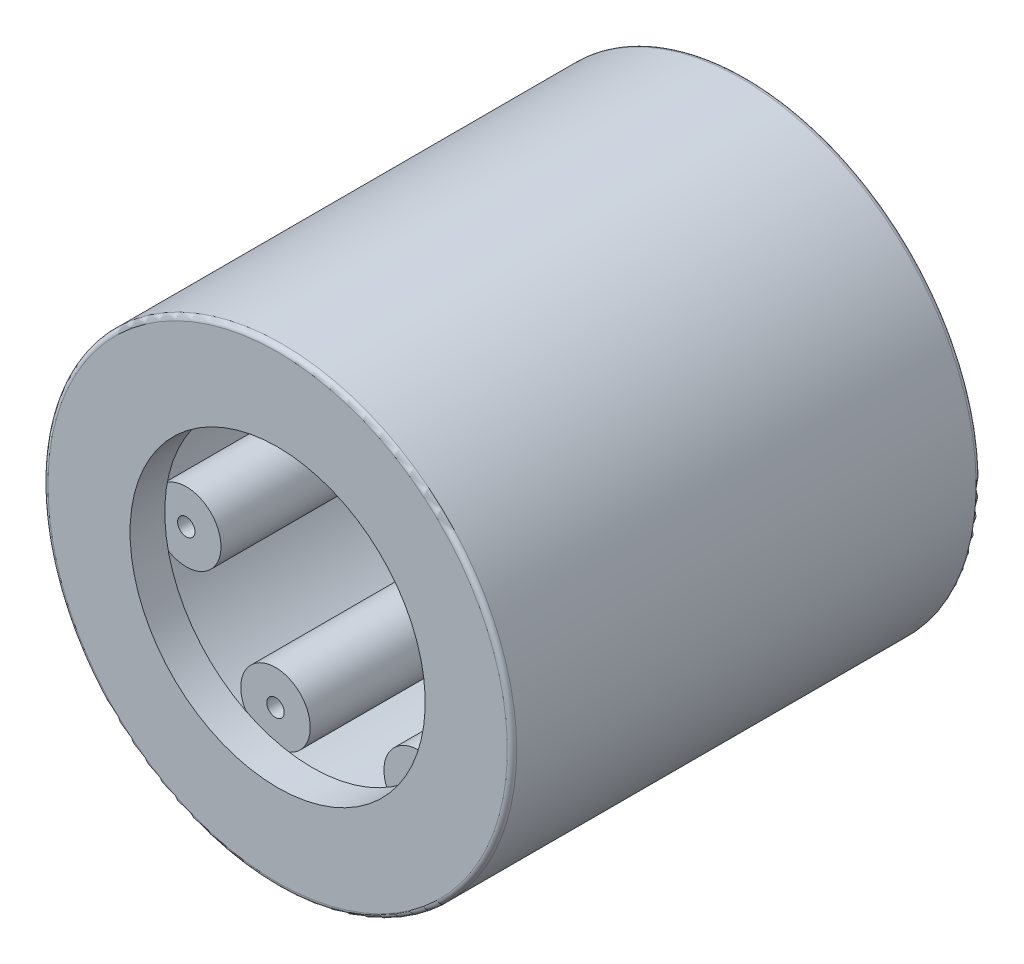
from build123d import *

# Parameters (mm, degrees)
SKETCH2_W         = 6.333333334
SKETCH2_H         = 0.5
SKETCH3_W         = 7.666666666
SKETCH3_H         = 0.166666666
CIRPATTERN1_COUNT = 7
CIRPATTERN1_ANGLE = 308.571428571
FILLET1_R         = 0.09


with BuildPart() as part:
    # Sketch7 → Revolve1 (revolve)
    with BuildSketch(Plane(origin=(0, 0, 0), x_dir=(0, 0, -1), z_dir=(1, 0, 0)), mode=Mode.PRIVATE) as revolve1_sk:
        Polygon((-4.5, 4.5), (-4.5, 2.833333333), (-3.833333333, 2.833333333), (-3.833333333, 3.733333333), (3.833333333, 3.733333333), (3.833333333, 2.833333333), (4.5, 2.833333333), (4.5, 4.5), align=None)
    revolve(revolve1_sk.sketch.rotate(Axis((0, 0, 4.5), (0, 0, -1)), 180), axis=Axis((0, 0, 4.5), (0, 0, -1)))

    # Sketch2 → Revolve2 (revolve)
    with BuildSketch(Plane(origin=(0, 0, 0), x_dir=(0, 0, -1), z_dir=(1, 0, 0)), mode=Mode.PRIVATE) as revolve2_sk:
        with Locations((0, 3.583333333)):
            Rectangle(SKETCH2_W, SKETCH2_H)
    revolve(revolve2_sk.sketch.rotate(Axis((0, 3.166666667, 3.166666667), (0, 0, -1)), 180), axis=Axis((0, 3.166666667, 3.166666667), (0, 0, -1)))

    # CirPattern1: part ×7 about axis
    cirpattern1_axis = Axis((0, 0, 4.5), (0, 0, -1))


with BuildPart() as body_2:
    # Sketch3 → Revolve3 (revolve)
    with BuildSketch(Plane(origin=(0, 0, 0), x_dir=(0, 0, -1), z_dir=(1, 0, 0)), mode=Mode.PRIVATE) as revolve3_sk:
        with Locations((0, 3.25)):
            Rectangle(SKETCH3_W, SKETCH3_H)
    revolve(revolve3_sk.sketch.rotate(Axis((0, 3.166666667, 3.833333333), (0, 0, -1)), 90), axis=Axis((0, 3.166666667, 3.833333333), (0, 0, -1)))


with BuildPart() as part_1:
    add(part.part)
    for i in range(1, CIRPATTERN1_COUNT):
        add(part.part.rotate(cirpattern1_axis, i * CIRPATTERN1_ANGLE / (CIRPATTERN1_COUNT - 1)))

    # Fillet1
    fillet1_edges = [part_1.edges().sort_by_distance(p)[0] for p in [
        (0, 4.5, -4.5),
        (0, 4.5, 4.5),
    ]]
    fillet(fillet1_edges, radius=FILLET1_R)


solid = Compound([body_2.part, part_1.part])
